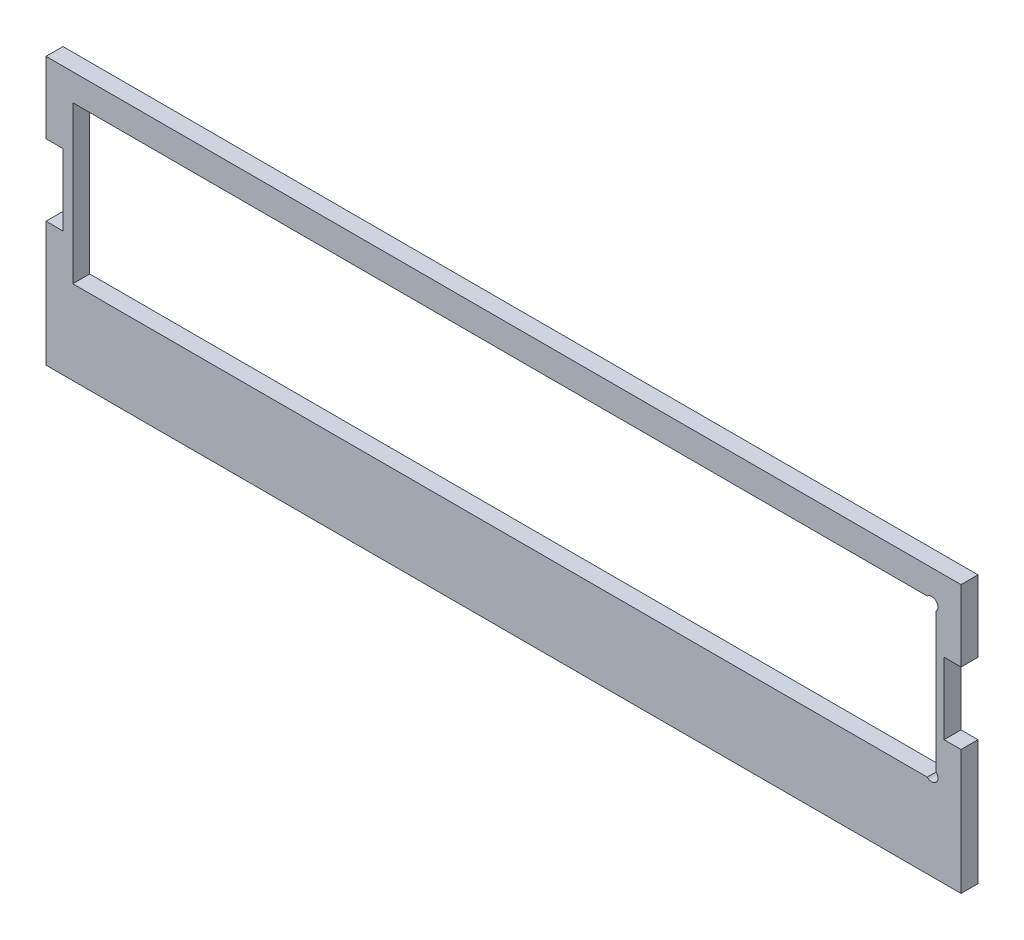
from build123d import *

# Parameters (mm, degrees)
SKETCH1_W           = 1025.461280364
SKETCH1_H           = 299.73488768
BOSS_EXTRUDE1_DEPTH = 19
SKETCH2_W           = 967.6
SKETCH2_H           = 175.74
CUT_EXTRUDE1_DEPTH  = 19
SKETCH3_R           = 7
CUT_EXTRUDE2_DEPTH  = 19
SKETCH5_W           = 19
SKETCH5_H           = 80
CUT_EXTRUDE3_DEPTH  = 19
SKETCH6_W           = 19
SKETCH6_H           = 80
CUT_EXTRUDE4_DEPTH  = 19


with BuildPart() as part:
    # Sketch1 → Boss-Extrude1 (new body)
    with BuildSketch(Plane.XY):
        with Locations((-1353.189241506, 613.368537441)):
            Rectangle(SKETCH1_W, SKETCH1_H)
    extrude(amount=BOSS_EXTRUDE1_DEPTH)

    # Sketch2 → Cut-Extrude1 (cut)
    with BuildSketch(Plane.XY.offset(19)):
        with Locations((-1352.119881688, 645.365981281)):
            Rectangle(SKETCH2_W, SKETCH2_H)
    extrude(amount=-CUT_EXTRUDE1_DEPTH, mode=Mode.SUBTRACT)

    # Sketch3 → Cut-Extrude2 (cut)
    with BuildSketch(Plane.XY.offset(19)):
        with Locations((-873.322364856, 728.339537454)):
            Circle(SKETCH3_R)
        with Locations((-873.322364856, 562.392425108)):
            Circle(SKETCH3_R)
    extrude(amount=-CUT_EXTRUDE2_DEPTH, mode=Mode.SUBTRACT)

    # Sketch5 → Cut-Extrude3 (cut)
    with BuildSketch(Plane(origin=(-840.458601324, 0, 0), x_dir=(0, 0, -1), z_dir=(1, 0, 0))):
        with Locations((-9.5, 643.235981281)):
            Rectangle(SKETCH5_W, SKETCH5_H)
    extrude(amount=-CUT_EXTRUDE3_DEPTH, mode=Mode.SUBTRACT)

    # Sketch6 → Cut-Extrude4 (cut)
    with BuildSketch(Plane.ZY.offset(1865.919881688)):
        with Locations((9.5, 643.235981281)):
            Rectangle(SKETCH6_W, SKETCH6_H)
    extrude(amount=-CUT_EXTRUDE4_DEPTH, mode=Mode.SUBTRACT)


solid = part.part
